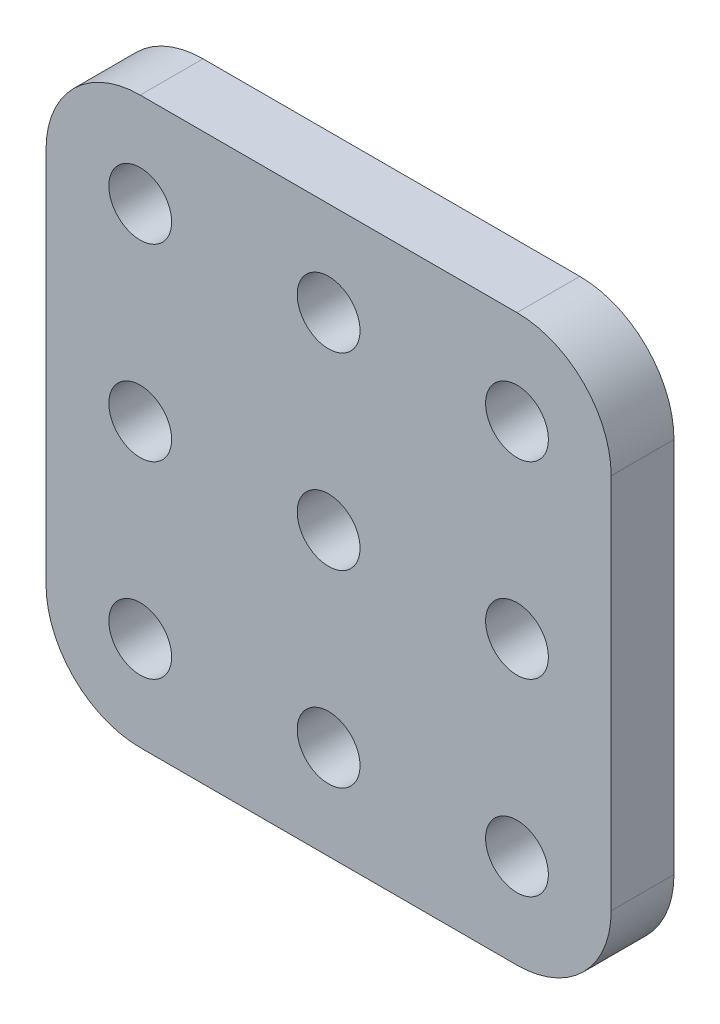
from build123d import *

# Parameters (mm, degrees)
MODEL_R                 = 1.5
SALIENTE_EXTRUIR1_DEPTH = 3


with BuildPart() as part:
    # Model → Saliente-Extruir1 (new body)
    with BuildSketch(Plane.XY):
        with BuildLine():
            Line((-105.943383637, 101.056539338), (-105.943383637, 83.056539338))
            ThreePointArc((-105.943383637, 83.056539338), (-104.625364152, 79.874558823), (-101.443383637, 78.556539338))
            Line((-101.443383637, 78.556539338), (-83.443383637, 78.556539338))
            ThreePointArc((-83.443383637, 78.556539338), (-80.261403122, 79.874558823), (-78.943383637, 83.056539338))
            Line((-78.943383637, 83.056539338), (-78.943383637, 101.056539338))
            ThreePointArc((-78.943383637, 101.056539338), (-80.261403122, 104.238519853), (-83.443383637, 105.556539338))
            Line((-83.443383637, 105.556539338), (-101.443383637, 105.556539338))
            ThreePointArc((-101.443383637, 105.556539338), (-104.625364152, 104.238519853), (-105.943383637, 101.056539338))
        make_face()
        with Locations((-101.443383637, 101.056539338)):
            Circle(MODEL_R, mode=Mode.SUBTRACT)
        with Locations((-92.443383637, 101.056539338)):
            Circle(MODEL_R, mode=Mode.SUBTRACT)
        with Locations((-83.443383637, 101.056539338)):
            Circle(MODEL_R, mode=Mode.SUBTRACT)
        with Locations((-101.443383637, 92.056539338)):
            Circle(MODEL_R, mode=Mode.SUBTRACT)
        with Locations((-92.443383637, 92.056539338)):
            Circle(MODEL_R, mode=Mode.SUBTRACT)
        with Locations((-83.443383637, 92.056539338)):
            Circle(MODEL_R, mode=Mode.SUBTRACT)
        with Locations((-101.443383637, 83.056539338)):
            Circle(MODEL_R, mode=Mode.SUBTRACT)
        with Locations((-92.443383637, 83.056539338)):
            Circle(MODEL_R, mode=Mode.SUBTRACT)
        with Locations((-83.443383637, 83.056539338)):
            Circle(MODEL_R, mode=Mode.SUBTRACT)
    extrude(amount=SALIENTE_EXTRUIR1_DEPTH)


solid = part.part
